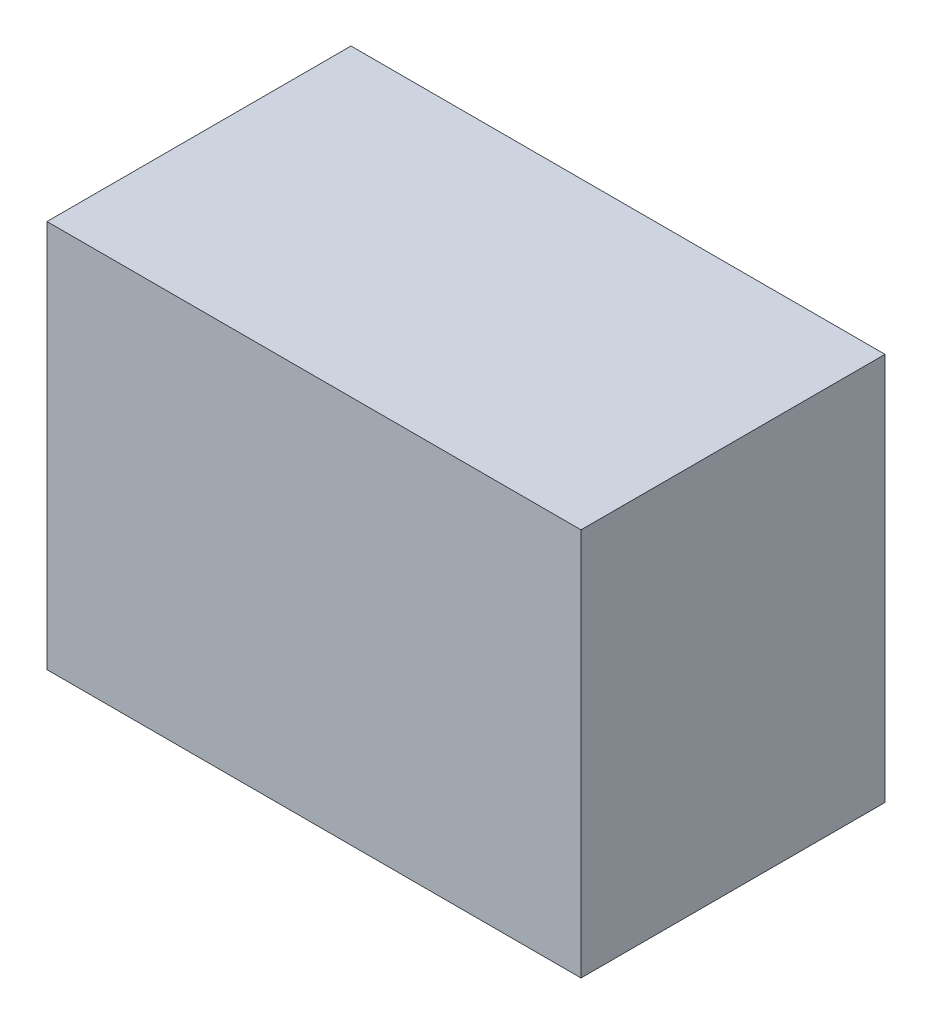
from build123d import *

# Parameters (mm, degrees)
SKETCH1_W      = 52.7
SKETCH1_H      = 38.3
ENVELOPE_DEPTH = 30


with BuildPart() as part:
    # Sketch1 → Envelope (new body)
    with BuildSketch(Plane.XY):
        Rectangle(SKETCH1_W, SKETCH1_H)
    extrude(amount=ENVELOPE_DEPTH)


solid = part.part
